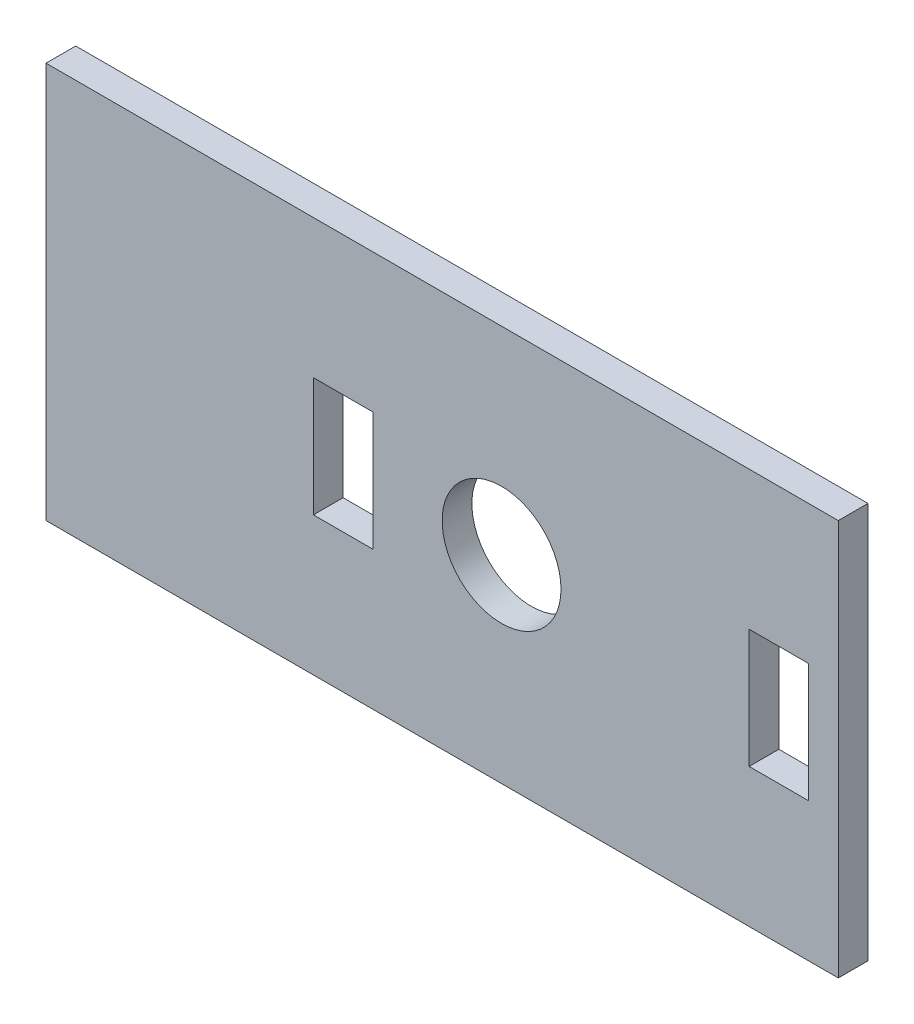
from build123d import *

# Parameters (mm, degrees)
SKETCH_1_W      = 40
SKETCH_1_H      = 20
SKETCH_1_R      = 3
SKETCH_1_W_2    = 3
SKETCH_1_H_2    = 6
EXTRUDE_1_DEPTH = 1.5


with BuildPart() as part:
    # 草图1 → 凸台-拉伸1 (new body)
    with BuildSketch(Plane.XY):
        Rectangle(SKETCH_1_W, SKETCH_1_H)
        with Locations((3, 0)):
            Circle(SKETCH_1_R, mode=Mode.SUBTRACT)
        with Locations((-5, 0)):
            Rectangle(SKETCH_1_W_2, SKETCH_1_H_2, mode=Mode.SUBTRACT)
        with Locations((17, 0)):
            Rectangle(SKETCH_1_W_2, SKETCH_1_H_2, mode=Mode.SUBTRACT)
    extrude(amount=EXTRUDE_1_DEPTH)


solid = part.part
